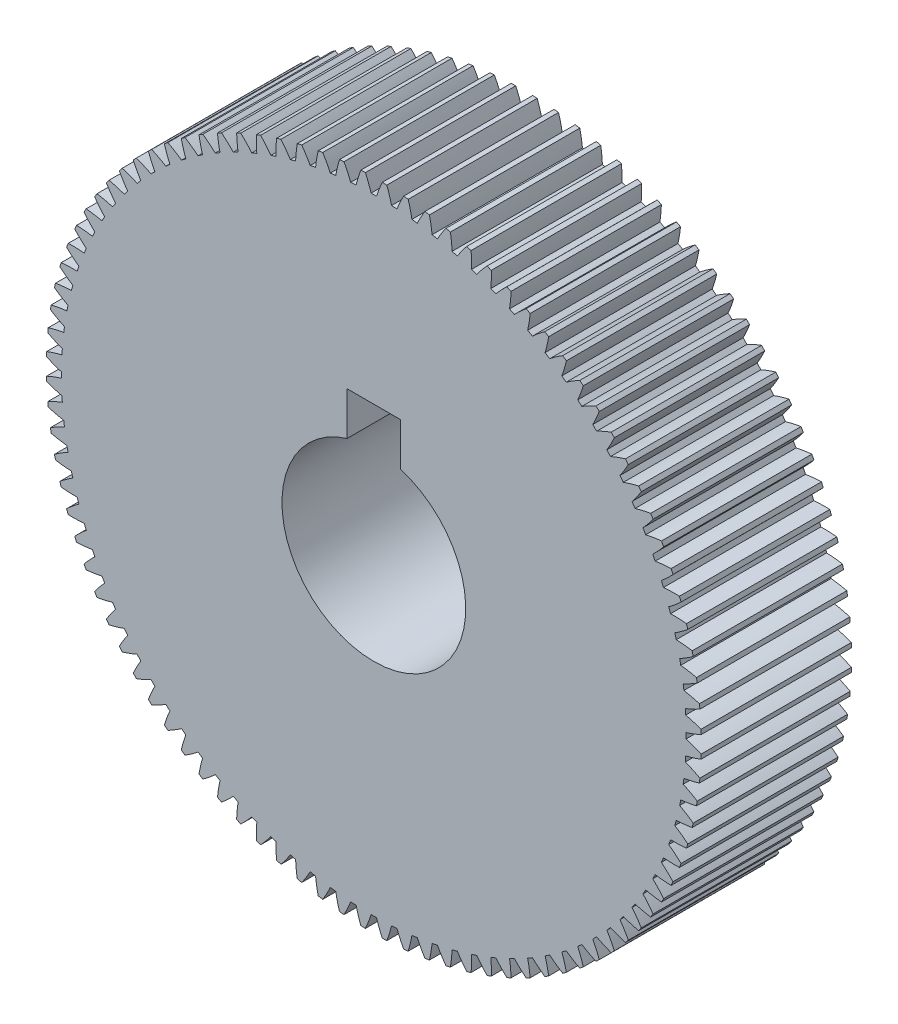
from build123d import *

# Parameters (mm, degrees)
EXTRUDE_1_DEPTH     = 45
CUT_EXTRUDE_1_DEPTH = 96


with BuildPart() as part:
    # Model → 凸台-拉伸1 (new body)
    with BuildSketch(Plane.XY):
        with BuildLine():
            ThreePointArc((-97.967489432, 2.524086835), (-95.758100973, 1.600439791), (-93.495436524, 0.816302804))
            ThreePointArc((-93.495436524, 0.816302804), (-93.499, 0), (-93.495436524, -0.816302804))
            ThreePointArc((-93.495436524, -0.816302804), (-95.758100973, -1.600439791), (-97.967489432, -2.524086835))
            ThreePointArc((-97.967489432, -2.524086835), (-97.947529573, -3.206470117), (-97.922816695, -3.8886978))
            ThreePointArc((-97.922816695, -3.8886978), (-95.657749299, -4.665866327), (-93.348644375, -5.300339081))
            ThreePointArc((-93.348644375, -5.300339081), (-93.298811464, -6.11512718), (-93.241866859, -6.929449154))
            ThreePointArc((-93.241866859, -6.929449154), (-95.448401758, -7.859892579), (-97.59265034, -8.926062943))
            ThreePointArc((-97.59265034, -8.926062943), (-97.528103214, -9.605679752), (-97.458823423, -10.284830434))
            ThreePointArc((-97.458823423, -10.284830434), (-95.147776456, -10.912192488), (-92.802119, -11.394284099))
            ThreePointArc((-92.802119, -11.394284099), (-92.699103094, -12.204068446), (-92.589021207, -13.012922539))
            ThreePointArc((-92.589021207, -13.012922539), (-94.729977833, -14.085688101), (-96.799904536, -15.289816279))
            ThreePointArc((-96.799904536, -15.289816279), (-96.691046544, -15.963756393), (-96.577496507, -16.636921846))
            ThreePointArc((-96.577496507, -16.636921846), (-94.230366228, -17.111790966), (-91.858200704, -17.439437044))
            ThreePointArc((-91.858200704, -17.439437044), (-91.702442932, -18.240750018), (-91.53969515, -19.040672593))
            ThreePointArc((-91.53969515, -19.040672593), (-93.6059056, -20.251166543), (-95.59264668, -21.588096275))
            ThreePointArc((-95.59264668, -21.588096275), (-95.439943969, -22.253473777), (-95.282609924, -22.917771404))
            ThreePointArc((-95.282609924, -22.917771404), (-92.909447105, -23.238114127), (-90.52093149, -23.409911642))
            ThreePointArc((-90.52093149, -23.409911642), (-90.313098832, -24.199321898), (-90.098382066, -24.986887563))
            ThreePointArc((-90.098382066, -24.986887563), (-92.080998508, -26.329926382), (-93.976046435, -27.793932728))
            ThreePointArc((-93.976046435, -27.793932728), (-93.780152902, -28.447898371), (-93.579708577, -29.100483546))
            ThreePointArc((-93.579708577, -29.100483546), (-91.190675465, -29.264928117), (-88.796037751, -29.280141405))
            ThreePointArc((-88.796037751, -29.280141405), (-88.537020178, -30.054268566), (-88.271253878, -30.826104844))
            ThreePointArc((-88.271253878, -30.826104844), (-90.161786444, -32.295937433), (-91.957026332, -33.880751294))
            ThreePointArc((-91.957026332, -33.880751294), (-91.718780822, -34.520504696), (-91.476084552, -35.158582951))
            ThreePointArc((-91.476084552, -35.158582951), (-89.081411354, -35.166425192), (-86.690905746, -35.024989107))
            ThreePointArc((-86.690905746, -35.024989107), (-86.38181241, -35.780518243), (-86.066134629, -36.533320012))
            ThreePointArc((-86.066134629, -36.533320012), (-87.856487769, -38.123652323), (-89.544232124, -39.822487281))
            ThreePointArc((-89.544232124, -39.822487281), (-89.264654842, -40.445288921), (-88.980745889, -41.066127905))
            ThreePointArc((-88.980745889, -41.066127905), (-86.590686963, -40.917334235), (-84.214549974, -40.619854428))
            ThreePointArc((-84.214549974, -40.619854428), (-83.856704461, -41.353550247), (-83.492466978, -42.084093895))
            ThreePointArc((-83.492466978, -42.084093895), (-85.174974125, -43.78811588), (-86.747995768, -45.593697265))
            ThreePointArc((-86.747995768, -45.593697265), (-86.428283906, -46.196880209), (-86.104378011, -46.797821395))
            ThreePointArc((-86.104378011, -46.797821395), (-83.729167956, -46.493028971), (-81.377574569, -46.040779297))
            ThreePointArc((-81.377574569, -46.040779297), (-80.972509228, -46.7495), (-80.561271766, -47.454657227))
            ThreePointArc((-80.561271766, -47.454657227), (-82.128728166, -49.265072003), (-83.580291176, -51.169668037))
            ThreePointArc((-83.580291176, -51.169668037), (-83.22181379, -51.750649364), (-82.859297968, -52.32911943))
            ThreePointArc((-82.859297968, -52.32911943), (-80.509107798, -51.869633419), (-78.192127897, -51.26455048))
            ThreePointArc((-78.192127897, -51.26455048), (-77.741577281, -51.945261217), (-77.28510082, -52.622012431))
            ThreePointArc((-77.28510082, -52.622012431), (-78.730794384, -54.531067523), (-80.054682945, -56.526522435))
            ThreePointArc((-80.054682945, -56.526522435), (-79.65897509, -57.082814293), (-79.25940169, -57.636336141))
            ThreePointArc((-79.25940169, -57.636336141), (-76.944295281, -57.024124134), (-74.671850529, -56.268798988))
            ThreePointArc((-74.671850529, -56.268798988), (-74.177743964, -56.918584851), (-73.677983207, -57.5640321))
            ThreePointArc((-73.677983207, -57.5640321), (-74.995723253, -59.563552641), (-76.186268272, -61.641321585))
            ThreePointArc((-76.186268272, -61.641321585), (-75.75502443, -62.170541848), (-75.320104486, -62.696745213))
            ThreePointArc((-75.320104486, -62.696745213), (-73.049995479, -61.934428794), (-70.831816834, -61.03209586))
            ThreePointArc((-70.831816834, -61.03209586), (-70.29627016, -61.648174366), (-69.755365159, -62.259553745))
            ThreePointArc((-69.755365159, -62.259553745), (-70.939508922, -64.340977483), (-71.991612302, -66.492163133))
            ThreePointArc((-71.991612302, -66.492163133), (-71.526679124, -66.992045598), (-71.058275031, -67.488677196))
            ThreePointArc((-71.058275031, -67.488677196), (-68.842884381, -66.579520723), (-66.688470424, -65.534043928))
            ThreePointArc((-66.688470424, -65.534043928), (-66.113776934, -66.113776934), (-65.534043928, -66.688470424))
            ThreePointArc((-65.534043928, -66.688470424), (-66.579520723, -68.842884381), (-67.488677196, -71.058275031))
            ThreePointArc((-67.488677196, -71.058275031), (-66.992045598, -71.526679124), (-66.492163133, -71.991612302))
            ThreePointArc((-66.492163133, -71.991612302), (-64.340977483, -70.939508922), (-62.259553746, -69.755365159))
            ThreePointArc((-62.259553746, -69.755365159), (-61.648174366, -70.296270159), (-61.03209586, -70.831816834))
            ThreePointArc((-61.03209586, -70.831816834), (-61.934428794, -73.049995479), (-62.696745213, -75.320104486))
            ThreePointArc((-62.696745213, -75.320104486), (-62.170541848, -75.75502443), (-61.641321585, -76.186268272))
            ThreePointArc((-61.641321585, -76.186268272), (-59.563552641, -74.995723253), (-57.5640321, -73.677983207))
            ThreePointArc((-57.5640321, -73.677983207), (-56.918584851, -74.177743964), (-56.268798988, -74.671850529))
            ThreePointArc((-56.268798988, -74.671850529), (-57.024124134, -76.944295281), (-57.636336141, -79.25940169))
            ThreePointArc((-57.636336141, -79.25940169), (-57.082814293, -79.65897509), (-56.526522435, -80.054682945))
            ThreePointArc((-56.526522435, -80.054682945), (-54.531067523, -78.730794384), (-52.622012431, -77.285100819))
            ThreePointArc((-52.622012431, -77.285100819), (-51.945261217, -77.741577281), (-51.26455048, -78.192127897))
            ThreePointArc((-51.26455048, -78.192127897), (-51.869633419, -80.509107798), (-52.32911943, -82.859297968))
            ThreePointArc((-52.32911943, -82.859297968), (-51.750649364, -83.22181379), (-51.169668037, -83.580291176))
            ThreePointArc((-51.169668037, -83.580291176), (-49.265072003, -82.128728166), (-47.454657227, -80.561271765))
            ThreePointArc((-47.454657227, -80.561271765), (-46.7495, -80.972509228), (-46.040779297, -81.377574569))
            ThreePointArc((-46.040779297, -81.377574569), (-46.493028971, -83.729167956), (-46.797821395, -86.104378011))
            ThreePointArc((-46.797821395, -86.104378011), (-46.196880209, -86.428283906), (-45.593697265, -86.747995768))
            ThreePointArc((-45.593697265, -86.747995768), (-43.78811588, -85.174974125), (-42.084093895, -83.492466978))
            ThreePointArc((-42.084093895, -83.492466978), (-41.353550247, -83.856704461), (-40.619854428, -84.214549974))
            ThreePointArc((-40.619854428, -84.214549974), (-40.917334235, -86.590686963), (-41.066127905, -88.980745888))
            ThreePointArc((-41.066127905, -88.980745888), (-40.445288921, -89.264654842), (-39.822487281, -89.544232124))
            ThreePointArc((-39.822487281, -89.544232124), (-38.123652323, -87.856487769), (-36.533320012, -86.066134629))
            ThreePointArc((-36.533320012, -86.066134629), (-35.780518243, -86.38181241), (-35.024989107, -86.690905746))
            ThreePointArc((-35.024989107, -86.690905746), (-35.166425192, -89.081411354), (-35.158582951, -91.476084552))
            ThreePointArc((-35.158582951, -91.476084552), (-34.520504696, -91.718780822), (-33.880751294, -91.957026332))
            ThreePointArc((-33.880751294, -91.957026332), (-32.295937434, -90.161786444), (-30.826104844, -88.271253878))
            ThreePointArc((-30.826104844, -88.271253878), (-30.054268566, -88.537020178), (-29.280141405, -88.796037751))
            ThreePointArc((-29.280141405, -88.796037751), (-29.264928117, -91.190675465), (-29.100483546, -93.579708577))
            ThreePointArc((-29.100483546, -93.579708577), (-28.447898371, -93.780152902), (-27.793932728, -93.976046435))
            ThreePointArc((-27.793932728, -93.976046435), (-26.329926382, -92.080998508), (-24.986887563, -90.098382066))
            ThreePointArc((-24.986887563, -90.098382066), (-24.199321898, -90.313098832), (-23.409911642, -90.52093149))
            ThreePointArc((-23.409911642, -90.52093149), (-23.238114128, -92.909447105), (-22.917771404, -95.282609924))
            ThreePointArc((-22.917771404, -95.282609924), (-22.253473777, -95.439943969), (-21.588096275, -95.59264668))
            ThreePointArc((-21.588096275, -95.59264668), (-20.251166543, -93.6059056), (-19.040672593, -91.53969515))
            ThreePointArc((-19.040672593, -91.53969515), (-18.240750018, -91.702442932), (-17.439437044, -91.858200704))
            ThreePointArc((-17.439437044, -91.858200704), (-17.111790966, -94.230366228), (-16.636921846, -96.577496507))
            ThreePointArc((-16.636921846, -96.577496507), (-15.963756393, -96.691046544), (-15.289816279, -96.799904536))
            ThreePointArc((-15.289816279, -96.799904536), (-14.085688101, -94.729977833), (-13.012922539, -92.589021207))
            ThreePointArc((-13.012922539, -92.589021207), (-12.204068446, -92.699103094), (-11.394284099, -92.802119))
            ThreePointArc((-11.394284099, -92.802119), (-10.912192488, -95.147776456), (-10.284830434, -97.458823423))
            ThreePointArc((-10.284830434, -97.458823423), (-9.605679752, -97.528103214), (-8.926062943, -97.59265034))
            ThreePointArc((-8.926062943, -97.59265034), (-7.859892579, -95.448401758), (-6.929449154, -93.241866859))
            ThreePointArc((-6.929449154, -93.241866859), (-6.11512718, -93.298811464), (-5.300339081, -93.348644375))
            ThreePointArc((-5.300339081, -93.348644375), (-4.665866327, -95.657749299), (-3.8886978, -97.922816695))
            ThreePointArc((-3.8886978, -97.922816695), (-3.206470117, -97.947529573), (-2.524086835, -97.967489432))
            ThreePointArc((-2.524086835, -97.967489432), (-1.600439791, -95.758100973), (-0.816302804, -93.495436524))
            ThreePointArc((-0.816302804, -93.495436524), (0, -93.499), (0.816302804, -93.495436524))
            ThreePointArc((0.816302804, -93.495436524), (1.600439791, -95.758100973), (2.524086835, -97.967489432))
            ThreePointArc((2.524086835, -97.967489432), (3.206470117, -97.947529573), (3.8886978, -97.922816695))
            ThreePointArc((3.8886978, -97.922816695), (4.665866327, -95.657749299), (5.300339081, -93.348644375))
            ThreePointArc((5.300339081, -93.348644375), (6.11512718, -93.298811464), (6.929449154, -93.241866859))
            ThreePointArc((6.929449154, -93.241866859), (7.859892579, -95.448401758), (8.926062943, -97.59265034))
            ThreePointArc((8.926062943, -97.59265034), (9.605679752, -97.528103214), (10.284830434, -97.458823423))
            ThreePointArc((10.284830434, -97.458823423), (10.912192488, -95.147776456), (11.394284099, -92.802119))
            ThreePointArc((11.394284099, -92.802119), (12.204068446, -92.699103094), (13.012922539, -92.589021207))
            ThreePointArc((13.012922539, -92.589021207), (14.085688101, -94.729977833), (15.289816279, -96.799904536))
            ThreePointArc((15.289816279, -96.799904536), (15.963756393, -96.691046544), (16.636921846, -96.577496507))
            ThreePointArc((16.636921846, -96.577496507), (17.111790966, -94.230366228), (17.439437044, -91.858200704))
            ThreePointArc((17.439437044, -91.858200704), (18.240750018, -91.702442932), (19.040672593, -91.53969515))
            ThreePointArc((19.040672593, -91.53969515), (20.251166543, -93.6059056), (21.588096275, -95.59264668))
            ThreePointArc((21.588096275, -95.59264668), (22.253473777, -95.439943969), (22.917771404, -95.282609924))
            ThreePointArc((22.917771404, -95.282609924), (23.238114127, -92.909447105), (23.409911642, -90.52093149))
            ThreePointArc((23.409911642, -90.52093149), (24.199321898, -90.313098832), (24.986887563, -90.098382066))
            ThreePointArc((24.986887563, -90.098382066), (26.329926382, -92.080998508), (27.793932728, -93.976046435))
            ThreePointArc((27.793932728, -93.976046435), (28.447898371, -93.780152902), (29.100483546, -93.579708577))
            ThreePointArc((29.100483546, -93.579708577), (29.264928117, -91.190675465), (29.280141405, -88.796037751))
            ThreePointArc((29.280141405, -88.796037751), (30.054268566, -88.537020178), (30.826104844, -88.271253878))
            ThreePointArc((30.826104844, -88.271253878), (32.295937433, -90.161786444), (33.880751294, -91.957026332))
            ThreePointArc((33.880751294, -91.957026332), (34.520504696, -91.718780822), (35.158582951, -91.476084552))
            ThreePointArc((35.158582951, -91.476084552), (35.166425192, -89.081411354), (35.024989107, -86.690905746))
            ThreePointArc((35.024989107, -86.690905746), (35.780518243, -86.38181241), (36.533320012, -86.066134629))
            ThreePointArc((36.533320012, -86.066134629), (38.123652323, -87.856487769), (39.822487281, -89.544232124))
            ThreePointArc((39.822487281, -89.544232124), (40.445288921, -89.264654842), (41.066127905, -88.980745889))
            ThreePointArc((41.066127905, -88.980745889), (40.917334235, -86.590686963), (40.619854428, -84.214549974))
            ThreePointArc((40.619854428, -84.214549974), (41.353550247, -83.856704461), (42.084093895, -83.492466978))
            ThreePointArc((42.084093895, -83.492466978), (43.78811588, -85.174974125), (45.593697265, -86.747995768))
            ThreePointArc((45.593697265, -86.747995768), (46.196880209, -86.428283906), (46.797821395, -86.104378011))
            ThreePointArc((46.797821395, -86.104378011), (46.493028971, -83.729167956), (46.040779297, -81.377574569))
            ThreePointArc((46.040779297, -81.377574569), (46.7495, -80.972509228), (47.454657227, -80.561271766))
            ThreePointArc((47.454657227, -80.561271766), (49.265072003, -82.128728166), (51.169668037, -83.580291176))
            ThreePointArc((51.169668037, -83.580291176), (51.750649364, -83.22181379), (52.32911943, -82.859297968))
            ThreePointArc((52.32911943, -82.859297968), (51.869633419, -80.509107798), (51.26455048, -78.192127897))
            ThreePointArc((51.26455048, -78.192127897), (51.945261217, -77.741577281), (52.622012431, -77.28510082))
            ThreePointArc((52.622012431, -77.28510082), (54.531067523, -78.730794384), (56.526522435, -80.054682945))
            ThreePointArc((56.526522435, -80.054682945), (57.082814293, -79.65897509), (57.636336141, -79.25940169))
            ThreePointArc((57.636336141, -79.25940169), (57.024124134, -76.944295281), (56.268798988, -74.671850529))
            ThreePointArc((56.268798988, -74.671850529), (56.918584851, -74.177743964), (57.5640321, -73.677983207))
            ThreePointArc((57.5640321, -73.677983207), (59.563552641, -74.995723253), (61.641321585, -76.186268272))
            ThreePointArc((61.641321585, -76.186268272), (62.170541848, -75.75502443), (62.696745213, -75.320104486))
            ThreePointArc((62.696745213, -75.320104486), (61.934428794, -73.049995479), (61.03209586, -70.831816834))
            ThreePointArc((61.03209586, -70.831816834), (61.648174366, -70.29627016), (62.259553745, -69.755365159))
            ThreePointArc((62.259553745, -69.755365159), (64.340977483, -70.939508922), (66.492163133, -71.991612302))
            ThreePointArc((66.492163133, -71.991612302), (66.992045598, -71.526679124), (67.488677196, -71.058275031))
            ThreePointArc((67.488677196, -71.058275031), (66.579520723, -68.842884381), (65.534043928, -66.688470424))
            ThreePointArc((65.534043928, -66.688470424), (66.113776934, -66.113776934), (66.688470424, -65.534043928))
            ThreePointArc((66.688470424, -65.534043928), (68.842884381, -66.579520723), (71.058275031, -67.488677196))
            ThreePointArc((71.058275031, -67.488677196), (71.526679124, -66.992045598), (71.991612302, -66.492163133))
            ThreePointArc((71.991612302, -66.492163133), (70.939508922, -64.340977483), (69.755365159, -62.259553746))
            ThreePointArc((69.755365159, -62.259553746), (70.296270159, -61.648174366), (70.831816834, -61.03209586))
            ThreePointArc((70.831816834, -61.03209586), (73.049995479, -61.934428794), (75.320104486, -62.696745213))
            ThreePointArc((75.320104486, -62.696745213), (75.75502443, -62.170541848), (76.186268272, -61.641321585))
            ThreePointArc((76.186268272, -61.641321585), (74.995723253, -59.563552641), (73.677983207, -57.5640321))
            ThreePointArc((73.677983207, -57.5640321), (74.177743964, -56.918584851), (74.671850529, -56.268798988))
            ThreePointArc((74.671850529, -56.268798988), (76.944295281, -57.024124134), (79.25940169, -57.636336141))
            ThreePointArc((79.25940169, -57.636336141), (79.65897509, -57.082814293), (80.054682945, -56.526522435))
            ThreePointArc((80.054682945, -56.526522435), (78.730794384, -54.531067523), (77.285100819, -52.622012431))
            ThreePointArc((77.285100819, -52.622012431), (77.741577281, -51.945261217), (78.192127897, -51.26455048))
            ThreePointArc((78.192127897, -51.26455048), (80.509107798, -51.869633419), (82.859297968, -52.32911943))
            ThreePointArc((82.859297968, -52.32911943), (83.22181379, -51.750649364), (83.580291176, -51.169668037))
            ThreePointArc((83.580291176, -51.169668037), (82.128728166, -49.265072003), (80.561271765, -47.454657227))
            ThreePointArc((80.561271765, -47.454657227), (80.972509228, -46.7495), (81.377574569, -46.040779297))
            ThreePointArc((81.377574569, -46.040779297), (83.729167956, -46.493028971), (86.104378011, -46.797821395))
            ThreePointArc((86.104378011, -46.797821395), (86.428283906, -46.196880209), (86.747995768, -45.593697265))
            ThreePointArc((86.747995768, -45.593697265), (85.174974125, -43.78811588), (83.492466978, -42.084093895))
            ThreePointArc((83.492466978, -42.084093895), (83.856704461, -41.353550247), (84.214549974, -40.619854428))
            ThreePointArc((84.214549974, -40.619854428), (86.590686963, -40.917334235), (88.980745888, -41.066127905))
            ThreePointArc((88.980745888, -41.066127905), (89.264654842, -40.445288921), (89.544232124, -39.822487281))
            ThreePointArc((89.544232124, -39.822487281), (87.856487769, -38.123652323), (86.066134629, -36.533320012))
            ThreePointArc((86.066134629, -36.533320012), (86.38181241, -35.780518243), (86.690905746, -35.024989107))
            ThreePointArc((86.690905746, -35.024989107), (89.081411354, -35.166425192), (91.476084552, -35.158582951))
            ThreePointArc((91.476084552, -35.158582951), (91.718780822, -34.520504696), (91.957026332, -33.880751294))
            ThreePointArc((91.957026332, -33.880751294), (90.161786444, -32.295937434), (88.271253878, -30.826104844))
            ThreePointArc((88.271253878, -30.826104844), (88.537020178, -30.054268566), (88.796037751, -29.280141405))
            ThreePointArc((88.796037751, -29.280141405), (91.190675465, -29.264928117), (93.579708577, -29.100483546))
            ThreePointArc((93.579708577, -29.100483546), (93.780152902, -28.447898371), (93.976046435, -27.793932728))
            ThreePointArc((93.976046435, -27.793932728), (92.080998508, -26.329926382), (90.098382066, -24.986887563))
            ThreePointArc((90.098382066, -24.986887563), (90.313098832, -24.199321898), (90.52093149, -23.409911642))
            ThreePointArc((90.52093149, -23.409911642), (92.909447105, -23.238114128), (95.282609924, -22.917771404))
            ThreePointArc((95.282609924, -22.917771404), (95.439943969, -22.253473777), (95.59264668, -21.588096275))
            ThreePointArc((95.59264668, -21.588096275), (93.6059056, -20.251166543), (91.53969515, -19.040672593))
            ThreePointArc((91.53969515, -19.040672593), (91.702442932, -18.240750018), (91.858200704, -17.439437044))
            ThreePointArc((91.858200704, -17.439437044), (94.230366228, -17.111790966), (96.577496507, -16.636921846))
            ThreePointArc((96.577496507, -16.636921846), (96.691046544, -15.963756393), (96.799904536, -15.289816279))
            ThreePointArc((96.799904536, -15.289816279), (94.729977833, -14.085688101), (92.589021207, -13.012922539))
            ThreePointArc((92.589021207, -13.012922539), (92.699103094, -12.204068446), (92.802119, -11.394284099))
            ThreePointArc((92.802119, -11.394284099), (95.147776456, -10.912192488), (97.458823423, -10.284830434))
            ThreePointArc((97.458823423, -10.284830434), (97.528103214, -9.605679752), (97.59265034, -8.926062943))
            ThreePointArc((97.59265034, -8.926062943), (95.448401758, -7.859892579), (93.241866859, -6.929449154))
            ThreePointArc((93.241866859, -6.929449154), (93.298811464, -6.11512718), (93.348644375, -5.300339081))
            ThreePointArc((93.348644375, -5.300339081), (95.657749299, -4.665866327), (97.922816695, -3.8886978))
            ThreePointArc((97.922816695, -3.8886978), (97.947529573, -3.206470117), (97.967489432, -2.524086835))
            ThreePointArc((97.967489432, -2.524086835), (95.758100973, -1.600439791), (93.495436524, -0.816302804))
            ThreePointArc((93.495436524, -0.816302804), (93.499, 0), (93.495436524, 0.816302804))
            ThreePointArc((93.495436524, 0.816302804), (95.758100973, 1.600439791), (97.967489432, 2.524086835))
            ThreePointArc((97.967489432, 2.524086835), (97.947529573, 3.206470117), (97.922816695, 3.8886978))
            ThreePointArc((97.922816695, 3.8886978), (95.657749299, 4.665866327), (93.348644375, 5.300339081))
            ThreePointArc((93.348644375, 5.300339081), (93.298811464, 6.11512718), (93.241866859, 6.929449154))
            ThreePointArc((93.241866859, 6.929449154), (95.448401758, 7.859892579), (97.59265034, 8.926062943))
            ThreePointArc((97.59265034, 8.926062943), (97.528103214, 9.605679752), (97.458823423, 10.284830434))
            ThreePointArc((97.458823423, 10.284830434), (95.147776456, 10.912192488), (92.802119, 11.394284099))
            ThreePointArc((92.802119, 11.394284099), (92.699103094, 12.204068446), (92.589021207, 13.012922539))
            ThreePointArc((92.589021207, 13.012922539), (94.729977833, 14.085688101), (96.799904536, 15.289816279))
            ThreePointArc((96.799904536, 15.289816279), (96.691046544, 15.963756393), (96.577496507, 16.636921846))
            ThreePointArc((96.577496507, 16.636921846), (94.230366228, 17.111790966), (91.858200704, 17.439437044))
            ThreePointArc((91.858200704, 17.439437044), (91.702442932, 18.240750018), (91.53969515, 19.040672593))
            ThreePointArc((91.53969515, 19.040672593), (93.6059056, 20.251166543), (95.59264668, 21.588096275))
            ThreePointArc((95.59264668, 21.588096275), (95.439943969, 22.253473777), (95.282609924, 22.917771404))
            ThreePointArc((95.282609924, 22.917771404), (92.909447105, 23.238114127), (90.52093149, 23.409911642))
            ThreePointArc((90.52093149, 23.409911642), (90.313098832, 24.199321898), (90.098382066, 24.986887563))
            ThreePointArc((90.098382066, 24.986887563), (92.080998508, 26.329926382), (93.976046435, 27.793932728))
            ThreePointArc((93.976046435, 27.793932728), (93.780152902, 28.447898371), (93.579708577, 29.100483546))
            ThreePointArc((93.579708577, 29.100483546), (91.190675465, 29.264928117), (88.796037751, 29.280141405))
            ThreePointArc((88.796037751, 29.280141405), (88.537020178, 30.054268566), (88.271253878, 30.826104844))
            ThreePointArc((88.271253878, 30.826104844), (90.161786444, 32.295937433), (91.957026332, 33.880751294))
            ThreePointArc((91.957026332, 33.880751294), (91.718780822, 34.520504696), (91.476084552, 35.158582951))
            ThreePointArc((91.476084552, 35.158582951), (89.081411354, 35.166425192), (86.690905746, 35.024989107))
            ThreePointArc((86.690905746, 35.024989107), (86.38181241, 35.780518243), (86.066134629, 36.533320012))
            ThreePointArc((86.066134629, 36.533320012), (87.856487769, 38.123652323), (89.544232124, 39.822487281))
            ThreePointArc((89.544232124, 39.822487281), (89.264654842, 40.445288921), (88.980745889, 41.066127905))
            ThreePointArc((88.980745889, 41.066127905), (86.590686963, 40.917334235), (84.214549974, 40.619854428))
            ThreePointArc((84.214549974, 40.619854428), (83.856704461, 41.353550247), (83.492466978, 42.084093895))
            ThreePointArc((83.492466978, 42.084093895), (85.174974125, 43.78811588), (86.747995768, 45.593697265))
            ThreePointArc((86.747995768, 45.593697265), (86.428283906, 46.196880209), (86.104378011, 46.797821395))
            ThreePointArc((86.104378011, 46.797821395), (83.729167956, 46.493028971), (81.377574569, 46.040779297))
            ThreePointArc((81.377574569, 46.040779297), (80.972509228, 46.7495), (80.561271766, 47.454657227))
            ThreePointArc((80.561271766, 47.454657227), (82.128728166, 49.265072003), (83.580291176, 51.169668037))
            ThreePointArc((83.580291176, 51.169668037), (83.22181379, 51.750649364), (82.859297968, 52.32911943))
            ThreePointArc((82.859297968, 52.32911943), (80.509107798, 51.869633419), (78.192127897, 51.26455048))
            ThreePointArc((78.192127897, 51.26455048), (77.741577281, 51.945261217), (77.28510082, 52.622012431))
            ThreePointArc((77.28510082, 52.622012431), (78.730794384, 54.531067523), (80.054682945, 56.526522435))
            ThreePointArc((80.054682945, 56.526522435), (79.65897509, 57.082814293), (79.25940169, 57.636336141))
            ThreePointArc((79.25940169, 57.636336141), (76.944295281, 57.024124134), (74.671850529, 56.268798988))
            ThreePointArc((74.671850529, 56.268798988), (74.177743964, 56.918584851), (73.677983207, 57.5640321))
            ThreePointArc((73.677983207, 57.5640321), (74.995723253, 59.563552641), (76.186268272, 61.641321585))
            ThreePointArc((76.186268272, 61.641321585), (75.75502443, 62.170541848), (75.320104486, 62.696745213))
            ThreePointArc((75.320104486, 62.696745213), (73.049995479, 61.934428794), (70.831816834, 61.03209586))
            ThreePointArc((70.831816834, 61.03209586), (70.29627016, 61.648174366), (69.755365159, 62.259553745))
            ThreePointArc((69.755365159, 62.259553745), (70.939508922, 64.340977483), (71.991612302, 66.492163133))
            ThreePointArc((71.991612302, 66.492163133), (71.526679124, 66.992045598), (71.058275031, 67.488677196))
            ThreePointArc((71.058275031, 67.488677196), (68.842884381, 66.579520723), (66.688470424, 65.534043928))
            ThreePointArc((66.688470424, 65.534043928), (66.113776934, 66.113776934), (65.534043928, 66.688470424))
            ThreePointArc((65.534043928, 66.688470424), (66.579520723, 68.842884381), (67.488677196, 71.058275031))
            ThreePointArc((67.488677196, 71.058275031), (66.992045598, 71.526679124), (66.492163133, 71.991612302))
            ThreePointArc((66.492163133, 71.991612302), (64.340977483, 70.939508922), (62.259553746, 69.755365159))
            ThreePointArc((62.259553746, 69.755365159), (61.648174366, 70.296270159), (61.03209586, 70.831816834))
            ThreePointArc((61.03209586, 70.831816834), (61.934428794, 73.049995479), (62.696745213, 75.320104486))
            ThreePointArc((62.696745213, 75.320104486), (62.170541848, 75.75502443), (61.641321585, 76.186268272))
            ThreePointArc((61.641321585, 76.186268272), (59.563552641, 74.995723253), (57.5640321, 73.677983207))
            ThreePointArc((57.5640321, 73.677983207), (56.918584851, 74.177743964), (56.268798988, 74.671850529))
            ThreePointArc((56.268798988, 74.671850529), (57.024124134, 76.944295281), (57.636336141, 79.25940169))
            ThreePointArc((57.636336141, 79.25940169), (57.082814293, 79.65897509), (56.526522435, 80.054682945))
            ThreePointArc((56.526522435, 80.054682945), (54.531067523, 78.730794384), (52.622012431, 77.285100819))
            ThreePointArc((52.622012431, 77.285100819), (51.945261217, 77.741577281), (51.26455048, 78.192127897))
            ThreePointArc((51.26455048, 78.192127897), (51.869633419, 80.509107798), (52.32911943, 82.859297968))
            ThreePointArc((52.32911943, 82.859297968), (51.750649364, 83.22181379), (51.169668037, 83.580291176))
            ThreePointArc((51.169668037, 83.580291176), (49.265072003, 82.128728166), (47.454657227, 80.561271765))
            ThreePointArc((47.454657227, 80.561271765), (46.7495, 80.972509228), (46.040779297, 81.377574569))
            ThreePointArc((46.040779297, 81.377574569), (46.493028971, 83.729167956), (46.797821395, 86.104378011))
            ThreePointArc((46.797821395, 86.104378011), (46.196880209, 86.428283906), (45.593697265, 86.747995768))
            ThreePointArc((45.593697265, 86.747995768), (43.78811588, 85.174974125), (42.084093895, 83.492466978))
            ThreePointArc((42.084093895, 83.492466978), (41.353550247, 83.856704461), (40.619854428, 84.214549974))
            ThreePointArc((40.619854428, 84.214549974), (40.917334235, 86.590686963), (41.066127905, 88.980745888))
            ThreePointArc((41.066127905, 88.980745888), (40.445288921, 89.264654842), (39.822487281, 89.544232124))
            ThreePointArc((39.822487281, 89.544232124), (38.123652323, 87.856487769), (36.533320012, 86.066134629))
            ThreePointArc((36.533320012, 86.066134629), (35.780518243, 86.38181241), (35.024989107, 86.690905746))
            ThreePointArc((35.024989107, 86.690905746), (35.166425192, 89.081411354), (35.158582951, 91.476084552))
            ThreePointArc((35.158582951, 91.476084552), (34.520504696, 91.718780822), (33.880751294, 91.957026332))
            ThreePointArc((33.880751294, 91.957026332), (32.295937434, 90.161786444), (30.826104844, 88.271253878))
            ThreePointArc((30.826104844, 88.271253878), (30.054268566, 88.537020178), (29.280141405, 88.796037751))
            ThreePointArc((29.280141405, 88.796037751), (29.264928117, 91.190675465), (29.100483546, 93.579708577))
            ThreePointArc((29.100483546, 93.579708577), (28.447898371, 93.780152902), (27.793932728, 93.976046435))
            ThreePointArc((27.793932728, 93.976046435), (26.329926382, 92.080998508), (24.986887563, 90.098382066))
            ThreePointArc((24.986887563, 90.098382066), (24.199321898, 90.313098832), (23.409911642, 90.52093149))
            ThreePointArc((23.409911642, 90.52093149), (23.238114128, 92.909447105), (22.917771404, 95.282609924))
            ThreePointArc((22.917771404, 95.282609924), (22.253473777, 95.439943969), (21.588096275, 95.59264668))
            ThreePointArc((21.588096275, 95.59264668), (20.251166543, 93.6059056), (19.040672593, 91.53969515))
            ThreePointArc((19.040672593, 91.53969515), (18.240750018, 91.702442932), (17.439437044, 91.858200704))
            ThreePointArc((17.439437044, 91.858200704), (17.111790966, 94.230366228), (16.636921846, 96.577496507))
            ThreePointArc((16.636921846, 96.577496507), (15.963756393, 96.691046544), (15.289816279, 96.799904536))
            ThreePointArc((15.289816279, 96.799904536), (14.085688101, 94.729977833), (13.012922539, 92.589021207))
            ThreePointArc((13.012922539, 92.589021207), (12.204068446, 92.699103094), (11.394284099, 92.802119))
            ThreePointArc((11.394284099, 92.802119), (10.912192488, 95.147776457), (10.284830434, 97.458823423))
            ThreePointArc((10.284830434, 97.458823423), (9.605679752, 97.528103214), (8.926062943, 97.59265034))
            ThreePointArc((8.926062943, 97.59265034), (7.859892579, 95.448401758), (6.929449154, 93.241866859))
            ThreePointArc((6.929449154, 93.241866859), (6.11512718, 93.298811464), (5.300339081, 93.348644375))
            ThreePointArc((5.300339081, 93.348644375), (4.665866327, 95.657749299), (3.8886978, 97.922816695))
            ThreePointArc((3.8886978, 97.922816695), (3.206470117, 97.947529573), (2.524086835, 97.967489432))
            ThreePointArc((2.524086835, 97.967489432), (1.600439791, 95.758100973), (0.816302804, 93.495436524))
            ThreePointArc((0.816302804, 93.495436524), (0, 93.499), (-0.816302804, 93.495436524))
            ThreePointArc((-0.816302804, 93.495436524), (-1.600439791, 95.758100973), (-2.524086835, 97.967489432))
            ThreePointArc((-2.524086835, 97.967489432), (-3.206470117, 97.947529573), (-3.8886978, 97.922816695))
            ThreePointArc((-3.8886978, 97.922816695), (-4.665866327, 95.657749299), (-5.300339081, 93.348644375))
            ThreePointArc((-5.300339081, 93.348644375), (-6.11512718, 93.298811464), (-6.929449154, 93.241866859))
            ThreePointArc((-6.929449154, 93.241866859), (-7.859892579, 95.448401758), (-8.926062943, 97.59265034))
            ThreePointArc((-8.926062943, 97.59265034), (-9.605679752, 97.528103214), (-10.284830434, 97.458823423))
            ThreePointArc((-10.284830434, 97.458823423), (-10.912192488, 95.147776456), (-11.394284099, 92.802119))
            ThreePointArc((-11.394284099, 92.802119), (-12.204068446, 92.699103094), (-13.012922539, 92.589021207))
            ThreePointArc((-13.012922539, 92.589021207), (-14.085688101, 94.729977833), (-15.289816279, 96.799904536))
            ThreePointArc((-15.289816279, 96.799904536), (-15.963756393, 96.691046544), (-16.636921846, 96.577496507))
            ThreePointArc((-16.636921846, 96.577496507), (-17.111790966, 94.230366228), (-17.439437044, 91.858200704))
            ThreePointArc((-17.439437044, 91.858200704), (-18.240750018, 91.702442932), (-19.040672593, 91.53969515))
            ThreePointArc((-19.040672593, 91.53969515), (-20.251166543, 93.6059056), (-21.588096275, 95.59264668))
            ThreePointArc((-21.588096275, 95.59264668), (-22.253473777, 95.439943969), (-22.917771404, 95.282609924))
            ThreePointArc((-22.917771404, 95.282609924), (-23.238114127, 92.909447105), (-23.409911642, 90.52093149))
            ThreePointArc((-23.409911642, 90.52093149), (-24.199321898, 90.313098832), (-24.986887563, 90.098382066))
            ThreePointArc((-24.986887563, 90.098382066), (-26.329926382, 92.080998508), (-27.793932728, 93.976046435))
            ThreePointArc((-27.793932728, 93.976046435), (-28.447898371, 93.780152902), (-29.100483546, 93.579708577))
            ThreePointArc((-29.100483546, 93.579708577), (-29.264928117, 91.190675465), (-29.280141405, 88.796037751))
            ThreePointArc((-29.280141405, 88.796037751), (-30.054268566, 88.537020178), (-30.826104844, 88.271253878))
            ThreePointArc((-30.826104844, 88.271253878), (-32.295937433, 90.161786444), (-33.880751294, 91.957026332))
            ThreePointArc((-33.880751294, 91.957026332), (-34.520504696, 91.718780822), (-35.158582951, 91.476084552))
            ThreePointArc((-35.158582951, 91.476084552), (-35.166425192, 89.081411354), (-35.024989107, 86.690905746))
            ThreePointArc((-35.024989107, 86.690905746), (-35.780518243, 86.38181241), (-36.533320012, 86.066134629))
            ThreePointArc((-36.533320012, 86.066134629), (-38.123652323, 87.856487769), (-39.822487281, 89.544232124))
            ThreePointArc((-39.822487281, 89.544232124), (-40.445288921, 89.264654842), (-41.066127905, 88.980745889))
            ThreePointArc((-41.066127905, 88.980745889), (-40.917334235, 86.590686963), (-40.619854428, 84.214549974))
            ThreePointArc((-40.619854428, 84.214549974), (-41.353550247, 83.856704461), (-42.084093895, 83.492466978))
            ThreePointArc((-42.084093895, 83.492466978), (-43.78811588, 85.174974125), (-45.593697265, 86.747995768))
            ThreePointArc((-45.593697265, 86.747995768), (-46.196880209, 86.428283906), (-46.797821395, 86.104378011))
            ThreePointArc((-46.797821395, 86.104378011), (-46.493028971, 83.729167956), (-46.040779297, 81.377574569))
            ThreePointArc((-46.040779297, 81.377574569), (-46.7495, 80.972509228), (-47.454657227, 80.561271766))
            ThreePointArc((-47.454657227, 80.561271766), (-49.265072003, 82.128728166), (-51.169668037, 83.580291176))
            ThreePointArc((-51.169668037, 83.580291176), (-51.750649364, 83.22181379), (-52.32911943, 82.859297968))
            ThreePointArc((-52.32911943, 82.859297968), (-51.869633419, 80.509107798), (-51.26455048, 78.192127897))
            ThreePointArc((-51.26455048, 78.192127897), (-51.945261217, 77.741577281), (-52.622012431, 77.28510082))
            ThreePointArc((-52.622012431, 77.28510082), (-54.531067523, 78.730794384), (-56.526522435, 80.054682945))
            ThreePointArc((-56.526522435, 80.054682945), (-57.082814293, 79.65897509), (-57.636336141, 79.25940169))
            ThreePointArc((-57.636336141, 79.25940169), (-57.024124134, 76.944295281), (-56.268798988, 74.671850529))
            ThreePointArc((-56.268798988, 74.671850529), (-56.918584851, 74.177743964), (-57.5640321, 73.677983207))
            ThreePointArc((-57.5640321, 73.677983207), (-59.563552641, 74.995723253), (-61.641321585, 76.186268272))
            ThreePointArc((-61.641321585, 76.186268272), (-62.170541848, 75.75502443), (-62.696745213, 75.320104486))
            ThreePointArc((-62.696745213, 75.320104486), (-61.934428794, 73.049995479), (-61.03209586, 70.831816834))
            ThreePointArc((-61.03209586, 70.831816834), (-61.648174366, 70.29627016), (-62.259553745, 69.755365159))
            ThreePointArc((-62.259553745, 69.755365159), (-64.340977483, 70.939508922), (-66.492163133, 71.991612302))
            ThreePointArc((-66.492163133, 71.991612302), (-66.992045598, 71.526679124), (-67.488677196, 71.058275031))
            ThreePointArc((-67.488677196, 71.058275031), (-66.579520723, 68.842884381), (-65.534043928, 66.688470424))
            ThreePointArc((-65.534043928, 66.688470424), (-66.113776934, 66.113776934), (-66.688470424, 65.534043928))
            ThreePointArc((-66.688470424, 65.534043928), (-68.842884381, 66.579520723), (-71.058275031, 67.488677196))
            ThreePointArc((-71.058275031, 67.488677196), (-71.526679124, 66.992045598), (-71.991612302, 66.492163133))
            ThreePointArc((-71.991612302, 66.492163133), (-70.939508922, 64.340977483), (-69.755365159, 62.259553746))
            ThreePointArc((-69.755365159, 62.259553746), (-70.296270159, 61.648174366), (-70.831816834, 61.03209586))
            ThreePointArc((-70.831816834, 61.03209586), (-73.049995479, 61.934428794), (-75.320104486, 62.696745213))
            ThreePointArc((-75.320104486, 62.696745213), (-75.75502443, 62.170541848), (-76.186268272, 61.641321585))
            ThreePointArc((-76.186268272, 61.641321585), (-74.995723253, 59.563552641), (-73.677983207, 57.5640321))
            ThreePointArc((-73.677983207, 57.5640321), (-74.177743964, 56.918584851), (-74.671850529, 56.268798988))
            ThreePointArc((-74.671850529, 56.268798988), (-76.944295281, 57.024124134), (-79.25940169, 57.636336141))
            ThreePointArc((-79.25940169, 57.636336141), (-79.65897509, 57.082814293), (-80.054682945, 56.526522435))
            ThreePointArc((-80.054682945, 56.526522435), (-78.730794384, 54.531067523), (-77.285100819, 52.622012431))
            ThreePointArc((-77.285100819, 52.622012431), (-77.741577281, 51.945261217), (-78.192127897, 51.26455048))
            ThreePointArc((-78.192127897, 51.26455048), (-80.509107798, 51.869633419), (-82.859297968, 52.32911943))
            ThreePointArc((-82.859297968, 52.32911943), (-83.22181379, 51.750649364), (-83.580291176, 51.169668037))
            ThreePointArc((-83.580291176, 51.169668037), (-82.128728166, 49.265072003), (-80.561271765, 47.454657227))
            ThreePointArc((-80.561271765, 47.454657227), (-80.972509228, 46.7495), (-81.377574569, 46.040779297))
            ThreePointArc((-81.377574569, 46.040779297), (-83.729167956, 46.493028971), (-86.104378011, 46.797821395))
            ThreePointArc((-86.104378011, 46.797821395), (-86.428283906, 46.196880209), (-86.747995768, 45.593697265))
            ThreePointArc((-86.747995768, 45.593697265), (-85.174974125, 43.78811588), (-83.492466978, 42.084093895))
            ThreePointArc((-83.492466978, 42.084093895), (-83.856704461, 41.353550247), (-84.214549974, 40.619854428))
            ThreePointArc((-84.214549974, 40.619854428), (-86.590686963, 40.917334235), (-88.980745888, 41.066127905))
            ThreePointArc((-88.980745888, 41.066127905), (-89.264654842, 40.445288921), (-89.544232124, 39.822487281))
            ThreePointArc((-89.544232124, 39.822487281), (-87.856487769, 38.123652323), (-86.066134629, 36.533320012))
            ThreePointArc((-86.066134629, 36.533320012), (-86.38181241, 35.780518243), (-86.690905746, 35.024989107))
            ThreePointArc((-86.690905746, 35.024989107), (-89.081411354, 35.166425192), (-91.476084552, 35.158582951))
            ThreePointArc((-91.476084552, 35.158582951), (-91.718780822, 34.520504696), (-91.957026332, 33.880751294))
            ThreePointArc((-91.957026332, 33.880751294), (-90.161786444, 32.295937434), (-88.271253878, 30.826104844))
            ThreePointArc((-88.271253878, 30.826104844), (-88.537020178, 30.054268566), (-88.796037751, 29.280141405))
            ThreePointArc((-88.796037751, 29.280141405), (-91.190675465, 29.264928117), (-93.579708577, 29.100483546))
            ThreePointArc((-93.579708577, 29.100483546), (-93.780152902, 28.447898371), (-93.976046435, 27.793932728))
            ThreePointArc((-93.976046435, 27.793932728), (-92.080998508, 26.329926382), (-90.098382066, 24.986887563))
            ThreePointArc((-90.098382066, 24.986887563), (-90.313098832, 24.199321898), (-90.52093149, 23.409911642))
            ThreePointArc((-90.52093149, 23.409911642), (-92.909447105, 23.238114128), (-95.282609924, 22.917771404))
            ThreePointArc((-95.282609924, 22.917771404), (-95.439943969, 22.253473777), (-95.59264668, 21.588096275))
            ThreePointArc((-95.59264668, 21.588096275), (-93.6059056, 20.251166543), (-91.53969515, 19.040672593))
            ThreePointArc((-91.53969515, 19.040672593), (-91.702442932, 18.240750018), (-91.858200704, 17.439437044))
            ThreePointArc((-91.858200704, 17.439437044), (-94.230366228, 17.111790966), (-96.577496507, 16.636921846))
            ThreePointArc((-96.577496507, 16.636921846), (-96.691046544, 15.963756393), (-96.799904536, 15.289816279))
            ThreePointArc((-96.799904536, 15.289816279), (-94.729977833, 14.085688101), (-92.589021207, 13.012922539))
            ThreePointArc((-92.589021207, 13.012922539), (-92.699103094, 12.204068446), (-92.802119, 11.394284099))
            ThreePointArc((-92.802119, 11.394284099), (-95.147776457, 10.912192488), (-97.458823423, 10.284830434))
            ThreePointArc((-97.458823423, 10.284830434), (-97.528103214, 9.605679752), (-97.59265034, 8.926062943))
            ThreePointArc((-97.59265034, 8.926062943), (-95.448401758, 7.859892579), (-93.241866859, 6.929449154))
            ThreePointArc((-93.241866859, 6.929449154), (-93.298811464, 6.11512718), (-93.348644375, 5.300339081))
            ThreePointArc((-93.348644375, 5.300339081), (-95.657749299, 4.665866327), (-97.922816695, 3.8886978))
            ThreePointArc((-97.922816695, 3.8886978), (-97.947529573, 3.206470117), (-97.967489432, 2.524086835))
        make_face()
        with BuildLine():
            Line((6, 19.078784028), (6, 23.3))
            Line((6, 23.3), (-6, 23.3))
            Line((-6, 23.3), (-6, 19.078784028))
            ThreePointArc((-6, 19.078784028), (0, -20), (6, 19.078784028))
        make_face(mode=Mode.SUBTRACT)
    extrude(amount=EXTRUDE_1_DEPTH)

    # 草图1 → 切除-拉伸1 (cut)
    with BuildSketch(Plane.XY.offset(45)):
        with BuildLine():
            Line((8, 26.310644234), (8, 39.195190955))
            Line((8, 39.195190955), (-8, 39.195190955))
            Line((-8, 39.195190955), (-8, 26.310644234))
            ThreePointArc((-8, 26.310644234), (0, -27.5), (8, 26.310644234))
        make_face()
    extrude(amount=-CUT_EXTRUDE_1_DEPTH, mode=Mode.SUBTRACT)


solid = part.part
